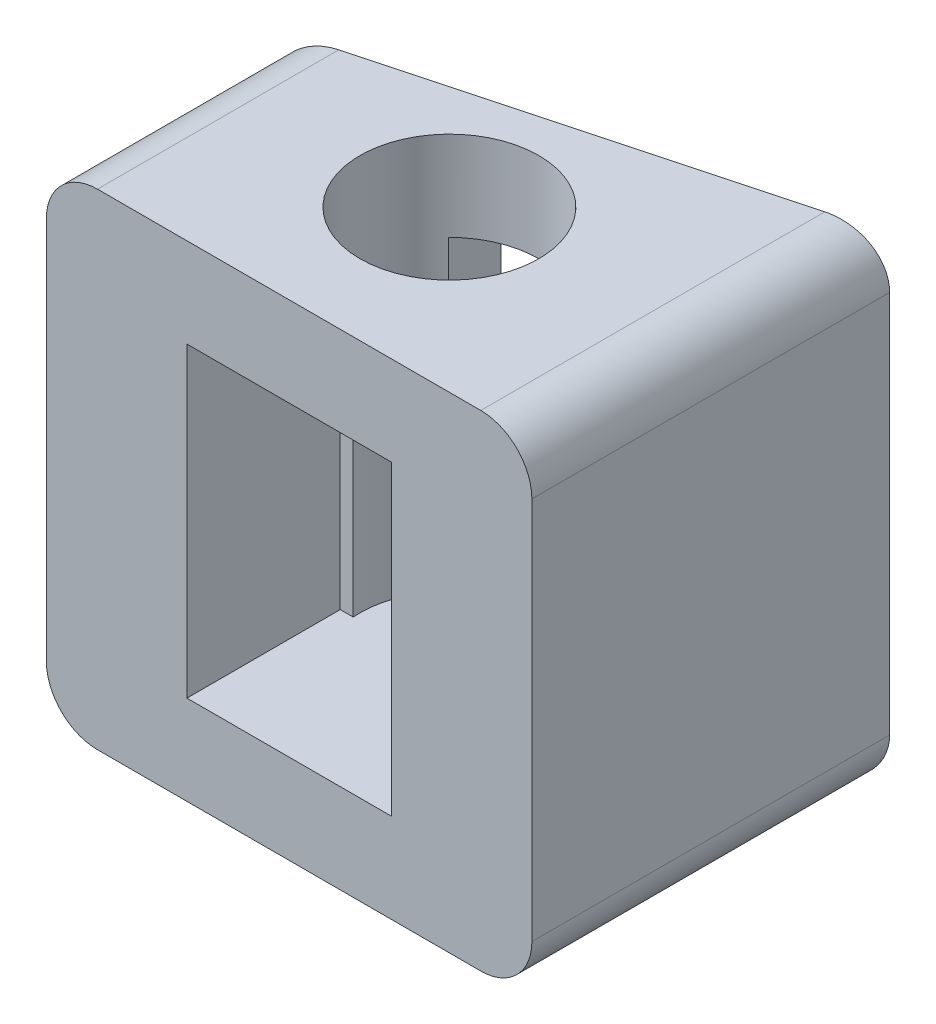
from build123d import *

# Parameters (mm, degrees)
BOSS_EXTRUDE1_DEPTH = 10
CUT_EXTRUDE1_DEPTH  = 5
SKETCH11_W          = 9.5
SKETCH11_H          = 3
CUT_EXTRUDE9_DEPTH  = 15.588094461
SKETCH17_W          = 2.5
SKETCH17_H          = 6
CUT_EXTRUDE13_DEPTH = 10.701803956
CUT_EXTRUDE14_REACH = 14.721
SKETCH16_R          = 1.75
SKETCH18_W          = 4
SKETCH18_H          = 6
CUT_EXTRUDE15_DEPTH = 3


with BuildPart() as part:
    # Sketch1 → Boss-Extrude1 (new body)
    with BuildSketch(Plane.XY):
        with BuildLine():
            Line((-3.75, 4.75), (3.75, 4.75))
            ThreePointArc((3.75, 4.75), (4.457106781, 4.457106781), (4.75, 3.75))
            Line((4.75, 3.75), (4.75, -3.75))
            ThreePointArc((4.75, -3.75), (4.457106781, -4.457106781), (3.75, -4.75))
            Line((3.75, -4.75), (-3.75, -4.75))
            ThreePointArc((-3.75, -4.75), (-4.457106781, -4.457106781), (-4.75, -3.75))
            Line((-4.75, -3.75), (-4.75, 3.75))
            ThreePointArc((-4.75, 3.75), (-4.457106781, 4.457106781), (-3.75, 4.75))
        make_face()
    extrude(amount=BOSS_EXTRUDE1_DEPTH)

    # Sketch2 → Cut-Extrude1 (cut, symmetric)
    with BuildSketch(Plane(origin=(0, 0, 0), x_dir=(1, 0, 0), z_dir=(0, 1, 0))):
        Polygon((4.75, 0), (-4.75, 0), (-4.75, -2.545517328), align=None)
    extrude(amount=CUT_EXTRUDE1_DEPTH, both=True, mode=Mode.SUBTRACT)

    # Sketch11 → Cut-Extrude9 (cut, through all)
    with BuildSketch(Plane(origin=(0, 4.75, 0), x_dir=(1, 0, 0), z_dir=(0, 1, 0))):
        with Locations((0, -8.5)):
            Rectangle(SKETCH11_W, SKETCH11_H)
    extrude(amount=-CUT_EXTRUDE9_DEPTH, mode=Mode.SUBTRACT)

    # Sketch17 → Cut-Extrude13 (cut, through all)
    with BuildSketch(Plane.XY.offset(7)):
        Rectangle(SKETCH17_W, SKETCH17_H)
    extrude(amount=-CUT_EXTRUDE13_DEPTH, mode=Mode.SUBTRACT)

    # Cut-Extrude14: up to this face of the body (flat: up to its plane)
    cut_extrude14_end = Plane(part.part.faces().sort_by_distance((0.024367206, -3, 4.133114745))[0])
    # Sketch16 → Cut-Extrude14 (cut, up to the picked face)
    with BuildSketch(Plane(origin=(0, 4.75, 0), x_dir=(1, 0, 0), z_dir=(0, 1, 0)), mode=Mode.PRIVATE) as cut_extrude14_sk1:
        with Locations(Location((-0.002235874, -3.861548216, 0), (0, 0, 270))):
            Circle(SKETCH16_R)
    cut_extrude14_tool1 = split(extrude(cut_extrude14_sk1.sketch, amount=-CUT_EXTRUDE14_REACH, mode=Mode.PRIVATE), bisect_by=cut_extrude14_end, keep=Keep.BOTH, mode=Mode.PRIVATE)
    add(cut_extrude14_tool1.solids().sort_by(Axis((-0.002236, 4.75, 3.861548), (0, -1, 0)))[0], mode=Mode.SUBTRACT)

    # Sketch18 → Cut-Extrude15 (cut)
    with BuildSketch(Plane.XY.offset(7)):
        Rectangle(SKETCH18_W, SKETCH18_H)
    extrude(amount=-CUT_EXTRUDE15_DEPTH, mode=Mode.SUBTRACT)


solid = part.part
